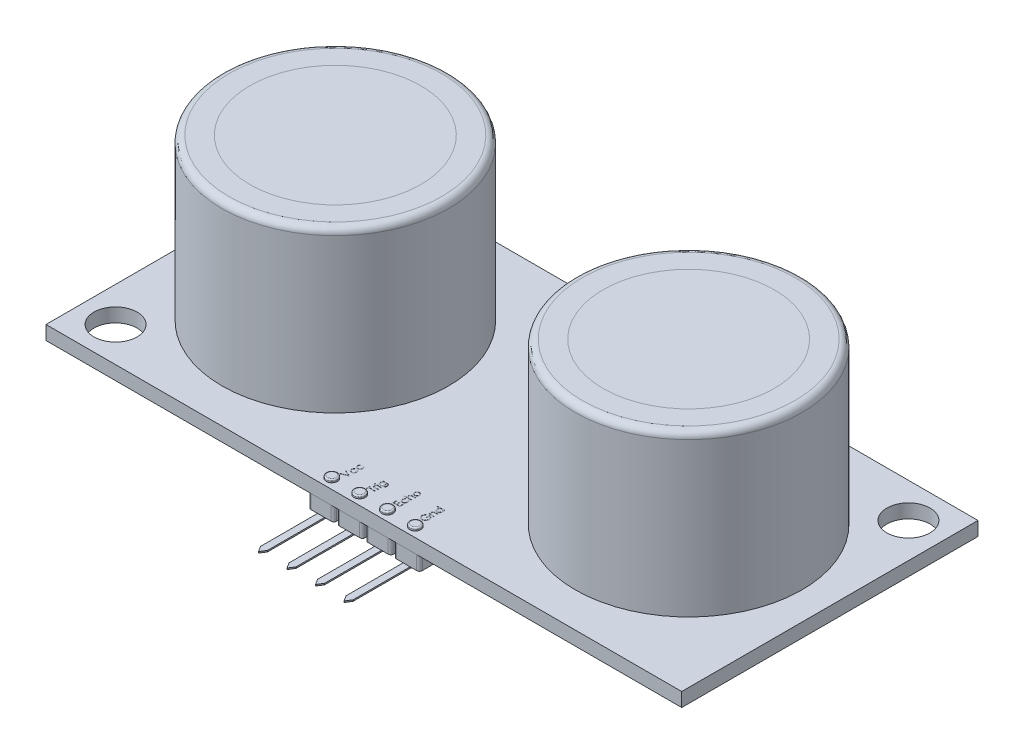
from build123d import *

# Parameters (mm, degrees)
SKETCH1_W              = 45.7
SKETCH1_H              = 21.3
SKETCH1_R              = 1.55
BOSS_EXTRUDE1_DEPTH    = 1
SKETCH2_R              = 8.15
SKETCH2_R_2            = 6.15
BOSS_EXTRUDE2_DEPTH    = 11.54
BOSS_EXTRUDE2_2_DEPTH  = 11.54
FILLET1_R              = 0.5
FILLET2_R              = 0.5
SKETCH3_R              = 6
BOSS_EXTRUDE3_DEPTH    = 7
BOSS_EXTRUDE3_2_DEPTH  = 7
LPATTERN2_COUNT        = 2
LPATTERN2_PITCH        = 25.4
SKETCH6_R              = 6.15
BOSS_EXTRUDE4_DEPTH    = 0.2
BOSS_EXTRUDE4_2_DEPTH  = 0.2
BOSS_EXTRUDE10_DEPTH   = 1
BOSS_EXTRUDE10_2_DEPTH = 1
BOSS_EXTRUDE10_3_DEPTH = 1
BOSS_EXTRUDE10_4_DEPTH = 1
SKETCH13_R             = 0.4
BOSS_EXTRUDE8_DEPTH    = 0.2
BOSS_EXTRUDE8_2_DEPTH  = 0.2
BOSS_EXTRUDE8_3_DEPTH  = 0.2
BOSS_EXTRUDE8_4_DEPTH  = 0.2
FILLET3_R              = 0.1
FILLET4_R              = 0.1
FILLET5_R              = 0.1
FILLET6_R              = 0.1
SKETCH15_W             = 0.365384615
SKETCH15_H             = 0.044871795
CUT_EXTRUDE5_DEPTH     = 0.01
BOSS_EXTRUDE11_DEPTH   = 0.1
BOSS_EXTRUDE11_2_DEPTH = 0.1
BOSS_EXTRUDE11_3_DEPTH = 0.1
BOSS_EXTRUDE11_4_DEPTH = 0.1
BOSS_EXTRUDE13_DEPTH   = 0.5
BOSS_EXTRUDE14_DEPTH   = 1.5
FILLET7_R              = 0.1


with BuildPart() as part:
    # Sketch1 → Boss-Extrude1 (new body)
    with BuildSketch(Plane(origin=(0, 0, 0), x_dir=(1, 0, 0), z_dir=(0, 1, 0))):
        Rectangle(SKETCH1_W, SKETCH1_H)
        with Locations(Location((20.35, 8.15, 0), (0, 0, 270))):
            Circle(SKETCH1_R, mode=Mode.SUBTRACT)
        with Locations(Location((-20.35, -8.15, 0), (0, 0, 270))):
            Circle(SKETCH1_R, mode=Mode.SUBTRACT)
    extrude(amount=BOSS_EXTRUDE1_DEPTH)

    # Sketch15 → Cut-Extrude5 (cut)
    # profile 1 of 15: a face of its own
    with BuildSketch(Plane(origin=(0, 1, 0), x_dir=(1, 0, 0), z_dir=(0, 1, 0))):
        with BuildLine():
            Line((-2.771008341, -8.073076923), (-2.747671001, -8.110637019))
            add(Edge.make_bspline(
                [(-2.747671001, -8.110637019), (-2.752789343, -8.114755571), (-2.76286393, -8.122862242), (-2.775865349, -8.136939276), (-2.787032069, -8.151940907), (-2.796132605, -8.168123485), (-2.803164241, -8.185464313), (-2.808139985, -8.203895006), (-2.811240591, -8.223412936), (-2.811592996, -8.236793678), (-2.811773565, -8.24364984)],
                knots=[0, 0, 0, 0, 1.026593902, 2.0206758, 2.988051866, 3.946915611, 4.916868779, 5.907761954, 6.927957743, 8, 8, 8, 8], degree=3))
            add(Edge.make_bspline(
                [(-2.811773565, -8.24364984), (-2.811622588, -8.249129691), (-2.811325242, -8.259922108), (-2.8094666, -8.275765844), (-2.80608917, -8.290857609), (-2.801639033, -8.305291996), (-2.795674706, -8.318966342), (-2.78841617, -8.331916473), (-2.779980449, -8.344257257), (-2.770207514, -8.355631077), (-2.759579133, -8.366035221), (-2.748185748, -8.375049352), (-2.736368621, -8.382897485), (-2.723832658, -8.389055479), (-2.71086465, -8.394094789), (-2.697219814, -8.397410035), (-2.683072955, -8.399619277), (-2.673427478, -8.399872038), (-2.668544398, -8.4)],
                knots=[0, 0, 0, 0, 1.112346261, 2.190735716, 3.231507886, 4.247384806, 5.251966152, 6.253067467, 7.256802811, 8.280671706, 9.291813951, 10.270744147, 11.225547591, 12.165006084, 13.100104208, 14.043489273, 15.009504848, 16, 16, 16, 16], degree=3))
            add(Edge.make_bspline(
                [(-2.668544398, -8.4), (-2.662149711, -8.399741969), (-2.649413775, -8.399228063), (-2.630645809, -8.395319409), (-2.612533755, -8.388779202), (-2.595175531, -8.379943686), (-2.579092049, -8.368728456), (-2.564665471, -8.355562063), (-2.552177566, -8.340430467), (-2.541824321, -8.323468787), (-2.533501276, -8.305074802), (-2.527571655, -8.28544765), (-2.523992745, -8.26474768), (-2.523541896, -8.250575287), (-2.523312027, -8.243349359)],
                knots=[0, 0, 0, 0, 0.96628757, 1.924499989, 2.884001032, 3.87047137, 4.860396324, 5.839257425, 6.814467993, 7.816059692, 8.834901047, 9.858382822, 10.908076205, 12, 12, 12, 12], degree=3))
            add(Edge.make_bspline(
                [(-2.523312027, -8.243349359), (-2.523497669, -8.23672719), (-2.523862506, -8.22371287), (-2.526938072, -8.204688972), (-2.531972877, -8.186577556), (-2.53899397, -8.169379266), (-2.548069329, -8.153125528), (-2.559263496, -8.13792136), (-2.572254439, -8.123464226), (-2.582299864, -8.114964658), (-2.587414591, -8.110637019)],
                knots=[0, 0, 0, 0, 1.039848629, 2.043578496, 3.018386758, 3.987534228, 4.954977003, 5.934852016, 6.948509513, 8, 8, 8, 8], degree=3))
            Line((-2.587414591, -8.110637019), (-2.562775168, -8.073076923))
            add(Edge.make_bspline(
                [(-2.562775168, -8.073076923), (-2.559505064, -8.075303738), (-2.55297571, -8.079749976), (-2.543769408, -8.087182494), (-2.535152024, -8.095199613), (-2.527135111, -8.103770055), (-2.519526823, -8.112781914), (-2.512690884, -8.122543043), (-2.506243052, -8.132738702), (-2.500441213, -8.143488582), (-2.495226024, -8.154681539), (-2.490741571, -8.166301823), (-2.486888699, -8.178298939), (-2.483826221, -8.190686993), (-2.481381815, -8.203490407), (-2.479759858, -8.216676069), (-2.478549104, -8.230239438), (-2.478476837, -8.239406888), (-2.478440232, -8.244050481)],
                knots=[0, 0, 0, 0, 0.954134338, 1.905101784, 2.851144739, 3.791306361, 4.734911809, 5.6936923, 6.663572882, 7.643865596, 8.638447847, 9.640600242, 10.646758161, 11.676244097, 12.717260333, 13.78922464, 14.880174919, 16, 16, 16, 16], degree=3))
            add(Edge.make_bspline(
                [(-2.478440232, -8.244050481), (-2.478567769, -8.251137657), (-2.478817743, -8.265028574), (-2.481558826, -8.285361669), (-2.485706466, -8.304787443), (-2.491608966, -8.323340034), (-2.499403895, -8.340906018), (-2.508707421, -8.357631633), (-2.519826998, -8.373344282), (-2.532498463, -8.387940957), (-2.546251285, -8.401289611), (-2.561005999, -8.41290504), (-2.576436566, -8.422748753), (-2.592640251, -8.430857682), (-2.60955061, -8.437198108), (-2.627270949, -8.441563266), (-2.645650922, -8.444379814), (-2.658184043, -8.444706284), (-2.664537988, -8.444871795)],
                knots=[0, 0, 0, 0, 1.113096611, 2.181677437, 3.217994567, 4.231807234, 5.234933164, 6.233258928, 7.234764453, 8.254006763, 9.267004511, 10.242118657, 11.199842941, 12.138404996, 13.084707599, 14.031460992, 15.002005182, 16, 16, 16, 16], degree=3))
            add(Edge.make_bspline(
                [(-2.664537988, -8.444871795), (-2.668849193, -8.444808793), (-2.677424891, -8.444683471), (-2.690152758, -8.443246052), (-2.702711122, -8.441389128), (-2.714940796, -8.438242594), (-2.727027266, -8.434608218), (-2.738824852, -8.429968856), (-2.750388376, -8.424526657), (-2.761688052, -8.418347807), (-2.772537986, -8.411392272), (-2.78278851, -8.403694953), (-2.792562762, -8.395545762), (-2.801523299, -8.386563461), (-2.810028469, -8.377129224), (-2.817851059, -8.366976142), (-2.825014057, -8.356162449), (-2.831649917, -8.344850546), (-2.837558407, -8.333047016), (-2.84264887, -8.320823206), (-2.846999238, -8.308252773), (-2.850443369, -8.295315609), (-2.853331572, -8.282097585), (-2.855148408, -8.268494536), (-2.856432161, -8.254558505), (-2.856573703, -8.24512193), (-2.85664536, -8.240344551)],
                knots=[0, 0, 0, 0, 0.990994727, 1.971252077, 2.943264845, 3.907940874, 4.872158414, 5.844625996, 6.82015047, 7.809835459, 8.804511986, 9.781214284, 10.756496977, 11.728388426, 12.696359165, 13.676225489, 14.672885716, 15.677705647, 16.690706858, 17.706033469, 18.721040654, 19.747369689, 20.783475414, 21.830280724, 22.901553713, 24, 24, 24, 24], degree=3))
            add(Edge.make_bspline(
                [(-2.85664536, -8.240344551), (-2.856513675, -8.234361671), (-2.856250963, -8.222425816), (-2.854039524, -8.204720112), (-2.850706512, -8.187274669), (-2.84576471, -8.170398053), (-2.839794347, -8.154285867), (-2.833049525, -8.139243645), (-2.825383038, -8.125498557), (-2.816841822, -8.112929361), (-2.807112014, -8.101539541), (-2.796292651, -8.091037172), (-2.784305854, -8.081353058), (-2.775477426, -8.075858402), (-2.771008341, -8.073076923)],
                knots=[0, 0, 0, 0, 1.095139042, 2.184804066, 3.262657822, 4.34424993, 5.400369085, 6.407210964, 7.359649996, 8.278719237, 9.185177137, 10.097389079, 11.036869154, 12, 12, 12, 12], degree=3))
        make_face()
    # profile 2 of 15: a face of its own
    with BuildSketch(Plane(origin=(0, 1, 0), x_dir=(1, 0, 0), z_dir=(0, 1, 0))):
        with BuildLine():
            Line((-2.771008341, -8.521794872), (-2.747671001, -8.559354968))
            add(Edge.make_bspline(
                [(-2.747671001, -8.559354968), (-2.752789343, -8.56347352), (-2.76286393, -8.571580191), (-2.775865349, -8.585657225), (-2.787032069, -8.600658855), (-2.796132605, -8.616841434), (-2.803164241, -8.634182262), (-2.808139985, -8.652612955), (-2.811240591, -8.672130884), (-2.811592996, -8.685511627), (-2.811773565, -8.692367788)],
                knots=[0, 0, 0, 0, 1.026593902, 2.0206758, 2.988051866, 3.946915611, 4.916868779, 5.907761954, 6.927957743, 8, 8, 8, 8], degree=3))
            add(Edge.make_bspline(
                [(-2.811773565, -8.692367788), (-2.811622588, -8.697847639), (-2.811325242, -8.708640057), (-2.8094666, -8.724483793), (-2.80608917, -8.739575558), (-2.801639033, -8.754009945), (-2.795674706, -8.76768429), (-2.78841617, -8.780634422), (-2.779980449, -8.792975206), (-2.770207514, -8.804349026), (-2.759579133, -8.81475317), (-2.748185748, -8.823767301), (-2.736368621, -8.831615434), (-2.723832658, -8.837773428), (-2.71086465, -8.842812738), (-2.697219814, -8.846127983), (-2.683072955, -8.848337226), (-2.673427478, -8.848589987), (-2.668544398, -8.848717949)],
                knots=[0, 0, 0, 0, 1.112346261, 2.190735716, 3.231507886, 4.247384806, 5.251966152, 6.253067467, 7.256802811, 8.280671706, 9.291813951, 10.270744147, 11.225547591, 12.165006084, 13.100104208, 14.043489273, 15.009504848, 16, 16, 16, 16], degree=3))
            add(Edge.make_bspline(
                [(-2.668544398, -8.848717949), (-2.662149711, -8.848459918), (-2.649413775, -8.847946012), (-2.630645809, -8.844037358), (-2.612533755, -8.837497151), (-2.595175531, -8.828661635), (-2.579092049, -8.817446404), (-2.564665471, -8.804280012), (-2.552177566, -8.789148415), (-2.541824321, -8.772186736), (-2.533501276, -8.75379275), (-2.527571655, -8.734165599), (-2.523992745, -8.713465628), (-2.523541896, -8.699293236), (-2.523312027, -8.692067308)],
                knots=[0, 0, 0, 0, 0.96628757, 1.924499989, 2.884001032, 3.87047137, 4.860396324, 5.839257425, 6.814467993, 7.816059692, 8.834901047, 9.858382822, 10.908076205, 12, 12, 12, 12], degree=3))
            add(Edge.make_bspline(
                [(-2.523312027, -8.692067308), (-2.523497669, -8.685445138), (-2.523862506, -8.672430819), (-2.526938072, -8.653406921), (-2.531972877, -8.635295505), (-2.53899397, -8.618097215), (-2.548069329, -8.601843477), (-2.559263496, -8.586639309), (-2.572254439, -8.572182175), (-2.582299864, -8.563682607), (-2.587414591, -8.559354968)],
                knots=[0, 0, 0, 0, 1.039848629, 2.043578496, 3.018386758, 3.987534228, 4.954977003, 5.934852016, 6.948509513, 8, 8, 8, 8], degree=3))
            Line((-2.587414591, -8.559354968), (-2.562775168, -8.521794872))
            add(Edge.make_bspline(
                [(-2.562775168, -8.521794872), (-2.559505064, -8.524021686), (-2.55297571, -8.528467925), (-2.543769408, -8.535900442), (-2.535152024, -8.543917561), (-2.527135111, -8.552488004), (-2.519526823, -8.561499862), (-2.512690884, -8.571260992), (-2.506243052, -8.581456651), (-2.500441213, -8.592206531), (-2.495226024, -8.603399487), (-2.490741571, -8.615019772), (-2.486888699, -8.627016888), (-2.483826221, -8.639404942), (-2.481381815, -8.652208356), (-2.479759858, -8.665394018), (-2.478549104, -8.678957386), (-2.478476837, -8.688124837), (-2.478440232, -8.692768429)],
                knots=[0, 0, 0, 0, 0.954134338, 1.905101784, 2.851144739, 3.791306361, 4.734911809, 5.6936923, 6.663572882, 7.643865596, 8.638447847, 9.640600242, 10.646758161, 11.676244097, 12.717260333, 13.78922464, 14.880174919, 16, 16, 16, 16], degree=3))
            add(Edge.make_bspline(
                [(-2.478440232, -8.692768429), (-2.478567769, -8.699855606), (-2.478817743, -8.713746523), (-2.481558826, -8.734079618), (-2.485706466, -8.753505392), (-2.491608966, -8.772057982), (-2.499403895, -8.789623967), (-2.508707421, -8.806349582), (-2.519826998, -8.82206223), (-2.532498463, -8.836658905), (-2.546251285, -8.85000756), (-2.561005999, -8.861622989), (-2.576436566, -8.871466702), (-2.592640251, -8.879575631), (-2.60955061, -8.885916057), (-2.627270949, -8.890281215), (-2.645650922, -8.893097763), (-2.658184043, -8.893424232), (-2.664537988, -8.893589744)],
                knots=[0, 0, 0, 0, 1.113096611, 2.181677437, 3.217994567, 4.231807234, 5.234933164, 6.233258928, 7.234764453, 8.254006763, 9.267004511, 10.242118657, 11.199842941, 12.138404996, 13.084707599, 14.031460992, 15.002005182, 16, 16, 16, 16], degree=3))
            add(Edge.make_bspline(
                [(-2.664537988, -8.893589744), (-2.668849193, -8.893526741), (-2.677424891, -8.893401419), (-2.690152758, -8.891964001), (-2.702711122, -8.890107076), (-2.714940796, -8.886960542), (-2.727027266, -8.883326167), (-2.738824852, -8.878686805), (-2.750388376, -8.873244606), (-2.761688052, -8.867065756), (-2.772537986, -8.860110221), (-2.78278851, -8.852412902), (-2.792562762, -8.844263711), (-2.801523299, -8.835281409), (-2.810028469, -8.825847173), (-2.817851059, -8.815694091), (-2.825014057, -8.804880398), (-2.831649917, -8.793568494), (-2.837558407, -8.781764964), (-2.84264887, -8.769541154), (-2.846999238, -8.756970721), (-2.850443369, -8.744033558), (-2.853331572, -8.730815533), (-2.855148408, -8.717212485), (-2.856432161, -8.703276453), (-2.856573703, -8.693839879), (-2.85664536, -8.6890625)],
                knots=[0, 0, 0, 0, 0.990994727, 1.971252077, 2.943264845, 3.907940874, 4.872158414, 5.844625996, 6.82015047, 7.809835459, 8.804511986, 9.781214284, 10.756496977, 11.728388426, 12.696359165, 13.676225489, 14.672885716, 15.677705647, 16.690706858, 17.706033469, 18.721040654, 19.747369689, 20.783475414, 21.830280724, 22.901553713, 24, 24, 24, 24], degree=3))
            add(Edge.make_bspline(
                [(-2.85664536, -8.6890625), (-2.856513675, -8.68307962), (-2.856250963, -8.671143765), (-2.854039524, -8.65343806), (-2.850706512, -8.635992617), (-2.84576471, -8.619116001), (-2.839794347, -8.603003815), (-2.833049525, -8.587961594), (-2.825383038, -8.574216505), (-2.816841822, -8.561647309), (-2.807112014, -8.550257489), (-2.796292651, -8.539755121), (-2.784305854, -8.530071007), (-2.775477426, -8.524576351), (-2.771008341, -8.521794872)],
                knots=[0, 0, 0, 0, 1.095139042, 2.184804066, 3.262657822, 4.34424993, 5.400369085, 6.407210964, 7.359649996, 8.278719237, 9.185177137, 10.097389079, 11.036869154, 12, 12, 12, 12], degree=3))
        make_face()
    # profile 3 of 15: a face of its own
    with BuildSketch(Plane(origin=(0, 1, 0), x_dir=(1, 0, 0), z_dir=(0, 1, 0))):
        Polygon((-2.984850488, -9.393589744), (-2.984850488, -9.345512821), (-2.590820039, -9.178846154), (-2.984850488, -9.012179487), (-2.984850488, -8.964102564), (-2.484850488, -9.175641026), (-2.484850488, -9.182051282), align=None)
    # profile 4 of 15: a face of its own
    with BuildSketch(Plane(origin=(0, 1, 0), x_dir=(1, 0, 0), z_dir=(0, 1, 0))):
        with BuildLine():
            Line((-0.997671001, -8.323076923), (-0.997671001, -8.278205128))
            Line((-0.997671001, -8.278205128), (-0.707707059, -8.278205128))
            add(Edge.make_bspline(
                [(-0.707707059, -8.278205128), (-0.701530259, -8.278244706), (-0.689607549, -8.2783211), (-0.672367795, -8.278871239), (-0.656444068, -8.280031335), (-0.641763746, -8.281346861), (-0.628394873, -8.283239249), (-0.616297558, -8.285550159), (-0.605460192, -8.288155256), (-0.598785214, -8.290443858), (-0.595627732, -8.291526442)],
                knots=[0, 0, 0, 0, 1.307562039, 2.523909702, 3.650326591, 4.686913197, 5.643429486, 6.506965704, 7.293745905, 8, 8, 8, 8], degree=3))
            add(Edge.make_bspline(
                [(-0.595627732, -8.291526442), (-0.591523467, -8.293124913), (-0.583437652, -8.29627406), (-0.571975468, -8.302171897), (-0.561183639, -8.308777152), (-0.551119247, -8.316319448), (-0.54184421, -8.324773833), (-0.533128421, -8.333892025), (-0.525299785, -8.343993911), (-0.518264274, -8.354902601), (-0.511803718, -8.366397845), (-0.50629187, -8.378566079), (-0.501694755, -8.391341933), (-0.497912126, -8.404666455), (-0.494860467, -8.418538869), (-0.492824357, -8.433005352), (-0.49145333, -8.448017017), (-0.491325565, -8.458223325), (-0.491260745, -8.463401442)],
                knots=[0, 0, 0, 0, 0.98202571, 1.934689484, 2.871054655, 3.802072519, 4.735470746, 5.668036537, 6.612630213, 7.581518814, 8.561763468, 9.551722253, 10.55777311, 11.588015789, 12.63986657, 13.723744117, 14.845153492, 16, 16, 16, 16], degree=3))
            add(Edge.make_bspline(
                [(-0.491260745, -8.463401442), (-0.491398444, -8.470954291), (-0.491667335, -8.485703082), (-0.494237549, -8.507250304), (-0.498383337, -8.527647451), (-0.504290118, -8.546745865), (-0.51159439, -8.564353393), (-0.519961827, -8.580371702), (-0.529561107, -8.594653137), (-0.540489557, -8.607527987), (-0.553484427, -8.619148203), (-0.56879853, -8.630080676), (-0.586665234, -8.640603667), (-0.599778478, -8.646770615), (-0.60664536, -8.65)],
                knots=[0, 0, 0, 0, 1.157856589, 2.260999188, 3.322382479, 4.345906448, 5.321474636, 6.242187631, 7.112686896, 7.955149481, 8.825136643, 9.778649332, 10.836767353, 12, 12, 12, 12], degree=3))
            Line((-0.60664536, -8.65), (-0.60664536, -8.605128205))
            add(Edge.make_bspline(
                [(-0.60664536, -8.605128205), (-0.600917786, -8.601517682), (-0.589721084, -8.594459554), (-0.575209435, -8.581304421), (-0.562921457, -8.566781581), (-0.552951172, -8.55058289), (-0.545275698, -8.53259537), (-0.539944399, -8.512702648), (-0.536718994, -8.490850286), (-0.536333356, -8.475632713), (-0.536132539, -8.467708333)],
                knots=[0, 0, 0, 0, 0.997887113, 1.950746426, 2.877762071, 3.798308985, 4.747694893, 5.754452072, 6.830656281, 8, 8, 8, 8], degree=3))
            add(Edge.make_bspline(
                [(-0.536132539, -8.467708333), (-0.536335992, -8.459884147), (-0.536728227, -8.4447999), (-0.53994568, -8.423114342), (-0.545277357, -8.403286508), (-0.552935516, -8.38553539), (-0.562134175, -8.369971421), (-0.57230764, -8.356477096), (-0.583915231, -8.345633881), (-0.594592505, -8.338312809), (-0.604111131, -8.333766176), (-0.61230383, -8.330868136), (-0.621538296, -8.328530902), (-0.631836565, -8.326524556), (-0.643202589, -8.324934754), (-0.65567513, -8.323891683), (-0.669169826, -8.323151364), (-0.678525914, -8.32310231), (-0.683368116, -8.323076923)],
                knots=[0, 0, 0, 0, 1.570880491, 3.028500349, 4.391799536, 5.683507043, 6.897971719, 8.016608159, 9.065046722, 10.074948333, 10.602832593, 11.179761774, 11.817338097, 12.514350094, 13.286299219, 14.121078732, 15.027572402, 16, 16, 16, 16], degree=3))
            Line((-0.683368116, -8.323076923), (-0.702298405, -8.323076923))
            add(Edge.make_bspline(
                [(-0.702298405, -8.323076923), (-0.696880347, -8.327632902), (-0.686139534, -8.336664722), (-0.672040067, -8.3522204), (-0.660043648, -8.369318353), (-0.650065029, -8.387716899), (-0.642159081, -8.407141835), (-0.636430531, -8.427249727), (-0.632877272, -8.447984125), (-0.632484744, -8.462018483), (-0.632286386, -8.469110577)],
                knots=[0, 0, 0, 0, 1.012670515, 2.007528466, 2.995541538, 3.996581493, 4.997861088, 5.991949332, 6.98525577, 8, 8, 8, 8], degree=3))
            add(Edge.make_bspline(
                [(-0.632286386, -8.469110577), (-0.632374509, -8.473285601), (-0.632549648, -8.481583134), (-0.63361503, -8.493945102), (-0.635689687, -8.506068824), (-0.638346295, -8.51803153), (-0.641907404, -8.529749643), (-0.646087008, -8.54136357), (-0.651220666, -8.552704648), (-0.657000461, -8.563830743), (-0.663494463, -8.574480094), (-0.670510718, -8.584619216), (-0.67803427, -8.594185751), (-0.686133585, -8.603091069), (-0.694798441, -8.611322851), (-0.703936073, -8.618991983), (-0.713674184, -8.625971602), (-0.723835177, -8.632404944), (-0.734486738, -8.637984594), (-0.745397894, -8.642882361), (-0.756545316, -8.647140847), (-0.767966325, -8.650535905), (-0.779653721, -8.653128921), (-0.791588356, -8.655058953), (-0.803806983, -8.656153658), (-0.812038604, -8.656324361), (-0.816180616, -8.656410256)],
                knots=[0, 0, 0, 0, 1.028710361, 2.044481286, 3.053267669, 4.056977562, 5.061496029, 6.068537106, 7.095799505, 8.125955792, 9.155750787, 10.166547241, 11.162135275, 12.151998358, 13.129411568, 14.10464185, 15.088574784, 16.079052837, 17.065149435, 18.048153627, 19.024354702, 20.002874835, 20.980703288, 21.971932454, 22.97951087, 24, 24, 24, 24], degree=3))
            add(Edge.make_bspline(
                [(-0.816180616, -8.656410256), (-0.820323916, -8.65633609), (-0.828594467, -8.656188044), (-0.840862951, -8.654909333), (-0.852967156, -8.653085305), (-0.864782319, -8.650198481), (-0.876442998, -8.646723835), (-0.887863063, -8.642420468), (-0.899045993, -8.637246359), (-0.910000069, -8.631387824), (-0.920578299, -8.624804382), (-0.930624963, -8.617585456), (-0.94006613, -8.609722331), (-0.948997048, -8.601323486), (-0.957331547, -8.592286369), (-0.965049399, -8.582615656), (-0.972279974, -8.572406673), (-0.978867308, -8.56162778), (-0.984693343, -8.550445296), (-0.990009429, -8.539143322), (-0.994228588, -8.527572146), (-0.997946174, -8.515947497), (-1.000579773, -8.504064652), (-1.002611522, -8.49206931), (-1.003849339, -8.479920405), (-1.004003852, -8.471784277), (-1.004081257, -8.467708333)],
                knots=[0, 0, 0, 0, 1.008818848, 2.013730394, 3.001654427, 3.987803273, 4.973046549, 5.963777569, 6.957074694, 7.972068341, 8.987420212, 9.989399531, 10.982630087, 11.977756091, 12.973280677, 13.973972381, 14.989194003, 16.018387222, 17.047741039, 18.059210846, 19.057554164, 20.045176975, 21.029480261, 22.018708529, 23.007435371, 24, 24, 24, 24], degree=3))
            add(Edge.make_bspline(
                [(-1.004081257, -8.467708333), (-1.003887447, -8.460986771), (-1.003504731, -8.44771375), (-1.00050171, -8.428180749), (-0.995713994, -8.409331858), (-0.988854618, -8.391060713), (-0.979490327, -8.373218477), (-0.96715562, -8.355863955), (-0.951739857, -8.338946935), (-0.939918019, -8.328507245), (-0.933768757, -8.323076923)],
                knots=[0, 0, 0, 0, 0.96728863, 1.910097829, 2.838038873, 3.762875196, 4.71315279, 5.730631239, 6.819562287, 8, 8, 8, 8], degree=3))
            Line((-0.933768757, -8.323076923), (-0.997671001, -8.323076923))
        make_face()
        with BuildLine():
            add(Edge.make_bspline(
                [(-0.959209462, -8.464102564), (-0.958985635, -8.470663676), (-0.958542503, -8.483653286), (-0.954785181, -8.502700557), (-0.948838122, -8.521046355), (-0.940560513, -8.538509789), (-0.930099085, -8.55468857), (-0.917652726, -8.569167271), (-0.903392187, -8.581790654), (-0.887501177, -8.592471897), (-0.87033042, -8.601004597), (-0.852239491, -8.606965045), (-0.83354441, -8.610904833), (-0.820807971, -8.611325885), (-0.814377732, -8.611538462)],
                knots=[0, 0, 0, 0, 1.026191648, 2.031641866, 3.026511193, 4.038688626, 5.047555432, 6.033268986, 7.01798463, 8.019529538, 9.022150945, 10.008736843, 10.994672018, 12, 12, 12, 12], degree=3))
            add(Edge.make_bspline(
                [(-0.814377732, -8.611538462), (-0.809530278, -8.611434365), (-0.799996755, -8.611229639), (-0.786003388, -8.609275066), (-0.772655107, -8.606077365), (-0.759964589, -8.601659433), (-0.747930218, -8.59601418), (-0.736552832, -8.589051405), (-0.725826064, -8.58080999), (-0.71584043, -8.571403184), (-0.70674619, -8.561034715), (-0.698754992, -8.549789226), (-0.692219188, -8.537681303), (-0.686570493, -8.52500891), (-0.682444913, -8.511464514), (-0.679296516, -8.497243217), (-0.677495265, -8.482244403), (-0.677272008, -8.472019868), (-0.67715818, -8.466806891)],
                knots=[0, 0, 0, 0, 1.039710933, 2.044807362, 3.024849673, 3.981007225, 4.923240656, 5.871799057, 6.837597342, 7.820855272, 8.810901995, 9.792827897, 10.773995565, 11.758948565, 12.765014796, 13.806304263, 14.881544521, 16, 16, 16, 16], degree=3))
            add(Edge.make_bspline(
                [(-0.67715818, -8.466806891), (-0.677267839, -8.461526354), (-0.677482275, -8.45120032), (-0.679325632, -8.436118758), (-0.6823002, -8.421828366), (-0.686523489, -8.408342249), (-0.691912311, -8.395609486), (-0.698731827, -8.383773112), (-0.706498175, -8.372579334), (-0.715557034, -8.362385561), (-0.725540605, -8.353167823), (-0.736404161, -8.345134857), (-0.747984235, -8.338289935), (-0.760279522, -8.332621697), (-0.773385572, -8.328294382), (-0.787269623, -8.325391681), (-0.801865157, -8.323362146), (-0.811866388, -8.323173443), (-0.816981898, -8.323076923)],
                knots=[0, 0, 0, 0, 1.121943988, 2.193949579, 3.223793937, 4.220241907, 5.192961521, 6.155822191, 7.11847367, 8.083710714, 9.04790392, 10.001595906, 10.949595423, 11.902125208, 12.873731292, 13.87582262, 14.913508608, 16, 16, 16, 16], degree=3))
            add(Edge.make_bspline(
                [(-0.816981898, -8.323076923), (-0.82364145, -8.323268633), (-0.836651874, -8.323643168), (-0.85561197, -8.327166515), (-0.873457556, -8.33288198), (-0.890142968, -8.34081413), (-0.905435801, -8.350799757), (-0.918948802, -8.362944844), (-0.931054645, -8.376711981), (-0.941008495, -8.392437847), (-0.949122007, -8.409269981), (-0.955011523, -8.426960133), (-0.958478604, -8.445337173), (-0.958964441, -8.457811434), (-0.959209462, -8.464102564)],
                knots=[0, 0, 0, 0, 1.070678282, 2.091729125, 3.090678259, 4.078281522, 5.055707048, 6.018451281, 6.993304669, 7.996175111, 9.002951586, 9.993356152, 10.987991402, 12, 12, 12, 12], degree=3))
        make_face(mode=Mode.SUBTRACT)
    # profile 5 of 15: a face of its own
    with BuildSketch(Plane(origin=(0, 1, 0), x_dir=(1, 0, 0), z_dir=(0, 1, 0))):
        with BuildLine():
            add(Edge.make_bspline(
                [(-1.151517155, -8.768790064), (-1.15138799, -8.76600559), (-1.151135061, -8.760553056), (-1.148969136, -8.752668304), (-1.145297752, -8.74548873), (-1.140372083, -8.739120483), (-1.134579306, -8.733655928), (-1.127827739, -8.729830112), (-1.120533648, -8.727371198), (-1.115445778, -8.727074262), (-1.112855296, -8.726923077)],
                knots=[0, 0, 0, 0, 1.055194115, 2.066272739, 3.074728998, 4.095836921, 5.109056067, 6.073838105, 7.019297344, 8, 8, 8, 8], degree=3))
            add(Edge.make_bspline(
                [(-1.112855296, -8.726923077), (-1.11033206, -8.727077671), (-1.10534392, -8.727383286), (-1.098176281, -8.729828213), (-1.091518527, -8.733688532), (-1.085736997, -8.739116979), (-1.080814051, -8.745489659), (-1.077141945, -8.752668057), (-1.074976211, -8.760553121), (-1.074723256, -8.766005612), (-1.074594078, -8.768790064)],
                knots=[0, 0, 0, 0, 0.96129708, 1.900370562, 2.859976407, 3.87933698, 4.906634145, 5.921202961, 6.938410037, 8, 8, 8, 8], degree=3))
            add(Edge.make_bspline(
                [(-1.074594078, -8.768790064), (-1.074718324, -8.771542675), (-1.074960152, -8.776900272), (-1.07718444, -8.784666964), (-1.080815308, -8.791785319), (-1.085704763, -8.798165987), (-1.091554034, -8.803484586), (-1.098172218, -8.807355775), (-1.105344955, -8.809795056), (-1.110332407, -8.810101431), (-1.112855296, -8.81025641)],
                knots=[0, 0, 0, 0, 1.054934014, 2.053291228, 3.073705704, 4.106921865, 5.123545215, 6.088680038, 7.033164197, 8, 8, 8, 8], degree=3))
            add(Edge.make_bspline(
                [(-1.112855296, -8.81025641), (-1.115445417, -8.810104826), (-1.120532579, -8.809807106), (-1.127831869, -8.807353947), (-1.134543512, -8.803516831), (-1.140404298, -8.798162465), (-1.145296503, -8.791786257), (-1.148926643, -8.784666722), (-1.15115112, -8.776900336), (-1.151392922, -8.771542697), (-1.151517155, -8.768790064)],
                knots=[0, 0, 0, 0, 0.98631895, 1.937192651, 2.907499808, 3.917963147, 4.944918757, 5.95915025, 6.951458133, 8, 8, 8, 8], degree=3))
        make_face()
    # profile 6 of 15: a face of its own
    with BuildSketch(Plane(origin=(0, 1, 0), x_dir=(1, 0, 0), z_dir=(0, 1, 0))):
        with Locations((-0.814978694, -8.768589744)):
            Rectangle(SKETCH15_W, SKETCH15_H)
    # profile 7 of 15: a face of its own
    with BuildSketch(Plane(origin=(0, 1, 0), x_dir=(1, 0, 0), z_dir=(0, 1, 0))):
        with BuildLine():
            Line((-0.997671001, -9.008974359), (-0.997671001, -8.964102564))
            Line((-0.997671001, -8.964102564), (-0.943884943, -8.964102564))
            add(Edge.make_bspline(
                [(-0.943884943, -8.964102564), (-0.948895161, -8.960792004), (-0.958477163, -8.954460583), (-0.971132965, -8.943887752), (-0.98173113, -8.933173527), (-0.990069549, -8.922036573), (-0.996371357, -8.910586078), (-1.00079944, -8.898918598), (-1.003545429, -8.887005603), (-1.003902409, -8.878980537), (-1.004081257, -8.874959936)],
                knots=[0, 0, 0, 0, 1.280091057, 2.448164201, 3.510831157, 4.48793739, 5.405868014, 6.289422536, 7.142991551, 8, 8, 8, 8], degree=3))
            add(Edge.make_bspline(
                [(-1.004081257, -8.874959936), (-1.003911182, -8.871841889), (-1.003561241, -8.865426306), (-1.001102552, -8.855714507), (-0.99717712, -8.8457083), (-0.99348566, -8.839259387), (-0.991561225, -8.835897436)],
                knots=[0, 0, 0, 0, 0.901110191, 1.854092781, 2.881294221, 4, 4, 4, 4], degree=3))
            Line((-0.991561225, -8.835897436), (-0.952699046, -8.860536859))
            add(Edge.make_bspline(
                [(-0.952699046, -8.860536859), (-0.953661941, -8.862695291), (-0.9554897, -8.866792407), (-0.957652845, -8.872785916), (-0.958926547, -8.878311822), (-0.959119506, -8.88183233), (-0.959209462, -8.883473558)],
                knots=[0, 0, 0, 0, 1.180555205, 2.24091978, 3.179933427, 4, 4, 4, 4], degree=3))
            add(Edge.make_bspline(
                [(-0.959209462, -8.883473558), (-0.958971337, -8.887075458), (-0.958485629, -8.89442229), (-0.954612677, -8.905172481), (-0.948535131, -8.915697534), (-0.941614604, -8.923975853), (-0.934966832, -8.930408263), (-0.929148566, -8.935034288), (-0.922564165, -8.939186215), (-0.915468132, -8.943213694), (-0.907682376, -8.946955526), (-0.899194196, -8.950299403), (-0.890073683, -8.953426571), (-0.883731978, -8.955187649), (-0.880483501, -8.956089744)],
                knots=[0, 0, 0, 0, 1.125322384, 2.295331465, 3.535939348, 4.916963136, 5.656144286, 6.429838446, 7.238666481, 8.090384391, 8.983239461, 9.940052224, 10.944811494, 12, 12, 12, 12], degree=3))
            add(Edge.make_bspline(
                [(-0.880483501, -8.956089744), (-0.877586922, -8.956766968), (-0.871139047, -8.958274491), (-0.860370848, -8.959701119), (-0.847656758, -8.961167459), (-0.832982009, -8.962168822), (-0.81629019, -8.963114743), (-0.79765331, -8.963637309), (-0.777020145, -8.964085938), (-0.762628594, -8.964096845), (-0.75508286, -8.964102564)],
                knots=[0, 0, 0, 0, 0.566841273, 1.261806378, 2.068780918, 3.007109044, 4.065315289, 5.256255371, 6.561408263, 8, 8, 8, 8], degree=3))
            Line((-0.75508286, -8.964102564), (-0.632286386, -8.964102564))
            Line((-0.632286386, -8.964102564), (-0.632286386, -9.008974359))
            Line((-0.632286386, -9.008974359), (-0.997671001, -9.008974359))
        make_face()
    # profile 8 of 15: a face of its own
    with BuildSketch(Plane(origin=(0, 1, 0), x_dir=(1, 0, 0), z_dir=(0, 1, 0))):
        Polygon((-1.081004334, -9.335897436), (-1.132286386, -9.335897436), (-1.132286386, -9.073076923), (-1.081004334, -9.073076923), (-1.081004334, -9.182051282), (-0.632286386, -9.182051282), (-0.632286386, -9.226923077), (-1.081004334, -9.226923077), align=None)
    # profile 9 of 15: a face of its own
    with BuildSketch(Plane(origin=(0, 1, 0), x_dir=(1, 0, 0), z_dir=(0, 1, 0))):
        with BuildLine():
            add(Edge.make_bspline(
                [(0.848482845, -7.877363782), (0.84862883, -7.870507886), (0.84891507, -7.857065149), (0.85197435, -7.837378308), (0.856652545, -7.818586146), (0.863119911, -7.80061669), (0.871788761, -7.783700076), (0.882132946, -7.767589899), (0.894387602, -7.752330326), (0.903867326, -7.743184179), (0.908679159, -7.738541667)],
                knots=[0, 0, 0, 0, 1.054011418, 2.066658804, 3.057071809, 4.030435133, 4.997543892, 5.974964718, 6.972108034, 8, 8, 8, 8], degree=3))
            add(Edge.make_bspline(
                [(0.908679159, -7.738541667), (0.913281157, -7.734544245), (0.922396092, -7.726626762), (0.937175465, -7.716474516), (0.952481194, -7.707728579), (0.968516526, -7.700719585), (0.985141479, -7.695193153), (1.002413195, -7.691269482), (1.02029353, -7.688935634), (1.032436936, -7.688620924), (1.038587012, -7.688461538)],
                knots=[0, 0, 0, 0, 1.025258237, 2.030674902, 3.01204498, 3.988269485, 4.97094183, 5.956517959, 6.965070386, 8, 8, 8, 8], degree=3))
            add(Edge.make_bspline(
                [(1.038587012, -7.688461538), (1.044772734, -7.68860173), (1.056996011, -7.688878754), (1.074998777, -7.69149927), (1.09245518, -7.69557514), (1.109292137, -7.701408259), (1.125561112, -7.708887989), (1.141191048, -7.71801523), (1.156212781, -7.728854033), (1.170498758, -7.741140318), (1.18366536, -7.754719157), (1.195140827, -7.769450036), (1.204972473, -7.785043469), (1.212891961, -7.801706805), (1.219136204, -7.819287875), (1.223521921, -7.837824599), (1.22617359, -7.85728818), (1.2265141, -7.870577783), (1.226687973, -7.877363782)],
                knots=[0, 0, 0, 0, 0.998656419, 1.973391657, 2.932242238, 3.890759089, 4.846373663, 5.82037756, 6.809684879, 7.83454468, 8.860553229, 9.859544525, 10.845671541, 11.83227036, 12.833544569, 13.85385346, 14.904124723, 16, 16, 16, 16], degree=3))
            add(Edge.make_bspline(
                [(1.226687973, -7.877363782), (1.226513517, -7.884183028), (1.226171835, -7.897538865), (1.223532223, -7.917071148), (1.219138225, -7.935641093), (1.212871441, -7.953245179), (1.20497222, -7.969980157), (1.19517055, -7.985663942), (1.183661957, -8.000406787), (1.17049968, -8.0139885), (1.156212543, -8.026274015), (1.141191109, -8.037113016), (1.125561096, -8.046240205), (1.109292141, -8.053719949), (1.092455179, -8.059553065), (1.074998777, -8.063628935), (1.056996011, -8.066249452), (1.044772734, -8.066526476), (1.038587012, -8.066666667)],
                knots=[0, 0, 0, 0, 1.099876186, 2.154163076, 3.173186993, 4.173200201, 5.163417411, 6.152872554, 7.150605724, 8.17532212, 9.198891216, 10.186952605, 11.159729845, 12.11414092, 13.071450619, 14.029093627, 15.002601286, 16, 16, 16, 16], degree=3))
            add(Edge.make_bspline(
                [(1.038587012, -8.066666667), (1.032470226, -8.066506575), (1.020360041, -8.066189621), (1.002515298, -8.063852588), (0.985296444, -8.05997161), (0.968762277, -8.054368566), (0.952765485, -8.047372582), (0.937403637, -8.038714669), (0.922688843, -8.028464218), (0.913585996, -8.020577494), (0.90897964, -8.016586538)],
                knots=[0, 0, 0, 0, 1.031377469, 2.041950136, 3.029500481, 4.003457997, 4.981637986, 5.969878303, 6.97268806, 8, 8, 8, 8], degree=3))
            add(Edge.make_bspline(
                [(0.90897964, -8.016586538), (0.904126077, -8.011951025), (0.894580692, -8.002834473), (0.88236176, -7.987498941), (0.871802321, -7.971428395), (0.863305719, -7.954324834), (0.856614502, -7.93637014), (0.851962286, -7.917481677), (0.848926092, -7.897728032), (0.848632067, -7.884219515), (0.848482845, -7.877363782)],
                knots=[0, 0, 0, 0, 1.027980169, 2.021703884, 2.998553061, 3.971491411, 4.943284454, 5.930300938, 6.949603206, 8, 8, 8, 8], degree=3))
        make_face()
        with BuildLine():
            add(Edge.make_bspline(
                [(0.89335464, -7.877564103), (0.893492439, -7.882412333), (0.893764479, -7.891983637), (0.895833609, -7.906072149), (0.899111823, -7.919635029), (0.903769546, -7.932698004), (0.909783671, -7.945217036), (0.917170593, -7.957204065), (0.925832394, -7.968694525), (0.935755827, -7.979462962), (0.946594962, -7.989347741), (0.958147334, -7.997981703), (0.970235984, -8.005364671), (0.982879104, -8.0114035), (0.996119803, -8.016034854), (1.009880104, -8.019316719), (1.02420156, -8.021389637), (1.033939148, -8.02165833), (1.038887493, -8.021794872)],
                knots=[0, 0, 0, 0, 1.02155314, 2.01673505, 2.994700672, 3.958461264, 4.934171024, 5.916582427, 6.921469794, 7.962398674, 8.998583302, 10.009097305, 10.997513862, 11.97957236, 12.956600784, 13.948243505, 14.957359924, 16, 16, 16, 16], degree=3))
            add(Edge.make_bspline(
                [(1.038887493, -8.021794872), (1.045280639, -8.021565326), (1.05796984, -8.021109719), (1.076657143, -8.017404685), (1.094597408, -8.011206645), (1.111685463, -8.002837034), (1.127495789, -7.992350431), (1.141591715, -7.979995136), (1.153761117, -7.96590375), (1.16385838, -7.95024425), (1.171881202, -7.933336491), (1.17756677, -7.915442731), (1.181262726, -7.896779774), (1.18163008, -7.884025384), (1.181816179, -7.877564103)],
                knots=[0, 0, 0, 0, 1.016792936, 2.018143844, 3.017858371, 4.030088057, 5.03801393, 6.028138512, 7.003788237, 7.991172063, 8.984598303, 9.972568034, 10.972917682, 12, 12, 12, 12], degree=3))
            add(Edge.make_bspline(
                [(1.181816179, -7.877564103), (1.181628996, -7.871103193), (1.181259502, -7.858349536), (1.177585385, -7.839712511), (1.17185629, -7.821867658), (1.163867403, -7.80497746), (1.153722773, -7.789325088), (1.141660433, -7.775132356), (1.127458454, -7.762882554), (1.111664522, -7.752406325), (1.0946239, -7.743899648), (1.076653832, -7.737730619), (1.057970683, -7.734016678), (1.045280922, -7.733562274), (1.038887493, -7.733333333)],
                knots=[0, 0, 0, 0, 1.02726834, 2.027799167, 3.010890988, 4.004497153, 4.992059811, 5.971914811, 6.958719428, 7.966827853, 8.981595046, 9.981490638, 10.983022906, 12, 12, 12, 12], degree=3))
            add(Edge.make_bspline(
                [(1.038887493, -7.733333333), (1.033939118, -7.733469828), (1.024201473, -7.733738429), (1.009880439, -7.735812021), (0.996118576, -7.739091396), (0.982883621, -7.743731904), (0.970203181, -7.749743909), (0.958182769, -7.757268806), (0.946554953, -7.765867504), (0.935790867, -7.775871541), (0.925828526, -7.786628739), (0.917167234, -7.798123854), (0.909816136, -7.810093109), (0.903718105, -7.822575771), (0.899154199, -7.835640421), (0.89581468, -7.849184297), (0.893773223, -7.863212699), (0.89349506, -7.872749705), (0.89335464, -7.877564103)],
                knots=[0, 0, 0, 0, 1.042975879, 2.052417305, 3.044379404, 4.0217225, 5.00409729, 5.996508862, 7.007348322, 8.048612455, 9.089876587, 10.095087598, 11.077815406, 12.047498138, 13.018202342, 13.98964644, 14.985148868, 16, 16, 16, 16], degree=3))
        make_face(mode=Mode.SUBTRACT)
    # profile 10 of 15: a face of its own
    with BuildSketch(Plane(origin=(0, 1, 0), x_dir=(1, 0, 0), z_dir=(0, 1, 0))):
        with BuildLine():
            Line((0.707457204, -8.476923077), (0.707457204, -8.432051282))
            Line((0.707457204, -8.432051282), (0.923903518, -8.432051282))
            add(Edge.make_bspline(
                [(0.923903518, -8.432051282), (0.917883624, -8.427234084), (0.906162582, -8.417854752), (0.890858824, -8.40207567), (0.877623602, -8.385830404), (0.866947863, -8.368694399), (0.858596505, -8.350817192), (0.852836222, -8.332173139), (0.849163234, -8.312837453), (0.848711624, -8.299689415), (0.848482845, -8.293028846)],
                knots=[0, 0, 0, 0, 1.125633083, 2.191665293, 3.205031882, 4.182434329, 5.134135993, 6.080017564, 7.027370072, 8, 8, 8, 8], degree=3))
            add(Edge.make_bspline(
                [(0.848482845, -8.293028846), (0.848717702, -8.286263917), (0.849177604, -8.273016681), (0.853241622, -8.253801295), (0.859635484, -8.235744949), (0.86871391, -8.219113542), (0.879925998, -8.204086395), (0.893005867, -8.190933586), (0.90795539, -8.179992816), (0.921847478, -8.172662166), (0.934206951, -8.167861926), (0.94481292, -8.164826899), (0.956630106, -8.162252438), (0.96965371, -8.160009708), (0.983945856, -8.158514883), (0.999442184, -8.157314232), (1.016141771, -8.15646045), (1.027701806, -8.156427364), (1.033679159, -8.156410256)],
                knots=[0, 0, 0, 0, 1.235771509, 2.41991536, 3.57472251, 4.727526861, 5.870395018, 6.992794988, 8.106410512, 9.245194824, 9.854018721, 10.52826073, 11.259975989, 12.064917182, 12.943387139, 13.886414983, 14.90712766, 16, 16, 16, 16], degree=3))
            Line((1.033679159, -8.156410256), (1.220277717, -8.156410256))
            Line((1.220277717, -8.156410256), (1.220277717, -8.201282051))
            Line((1.220277717, -8.201282051), (1.048402717, -8.201282051))
            add(Edge.make_bspline(
                [(1.048402717, -8.201282051), (1.043428044, -8.201309129), (1.03391234, -8.201360923), (1.020288693, -8.20153424), (1.007965156, -8.201912339), (0.996916148, -8.202545916), (0.987156642, -8.203183442), (0.978670697, -8.204087289), (0.971511549, -8.205131045), (0.96720232, -8.206069502), (0.965269704, -8.206490385)],
                knots=[0, 0, 0, 0, 1.430934443, 2.737134061, 3.918973087, 4.976914145, 5.92044225, 6.731742364, 7.431207999, 8, 8, 8, 8], degree=3))
            add(Edge.make_bspline(
                [(0.965269704, -8.206490385), (0.959594955, -8.208114851), (0.948714104, -8.211229627), (0.933960038, -8.218613836), (0.921267852, -8.22762254), (0.91099197, -8.238786956), (0.902928873, -8.251717566), (0.897348978, -8.266556484), (0.893884663, -8.283153689), (0.893536243, -8.294846832), (0.89335464, -8.300941506)],
                knots=[0, 0, 0, 0, 1.090133324, 2.090238182, 3.036763777, 3.954757083, 4.878717367, 5.838952881, 6.873623762, 8, 8, 8, 8], degree=3))
            add(Edge.make_bspline(
                [(0.89335464, -8.300941506), (0.893421637, -8.304551509), (0.893554222, -8.311695612), (0.894919046, -8.322283598), (0.897074601, -8.332586334), (0.900258549, -8.342576167), (0.904129627, -8.352273474), (0.908880214, -8.361717674), (0.914624186, -8.370779517), (0.921088969, -8.379575966), (0.928240727, -8.387764595), (0.935790568, -8.395382648), (0.943829776, -8.402173868), (0.952229812, -8.408326516), (0.961105777, -8.413637702), (0.97037211, -8.418273856), (0.980040987, -8.422207527), (0.98675171, -8.424162197), (0.990109448, -8.425140224)],
                knots=[0, 0, 0, 0, 1.024369801, 2.02720137, 3.025498567, 4.008789058, 4.999724648, 5.987391013, 7.005161842, 8.042127274, 9.083588116, 10.088924978, 11.084112559, 12.068088063, 13.041783903, 14.016724555, 15.007660144, 16, 16, 16, 16], degree=3))
            add(Edge.make_bspline(
                [(0.990109448, -8.425140224), (0.992541012, -8.425703), (0.99783969, -8.426929356), (1.00657888, -8.428260047), (1.016734076, -8.429451161), (1.028289876, -8.430458096), (1.041288624, -8.43107568), (1.055641619, -8.431741143), (1.071438764, -8.431988859), (1.082423837, -8.432029853), (1.088166339, -8.432051282)],
                knots=[0, 0, 0, 0, 0.607992626, 1.324890765, 2.152360218, 3.099583803, 4.150613268, 5.323148443, 6.60066238, 8, 8, 8, 8], degree=3))
            Line((1.088166339, -8.432051282), (1.220277717, -8.432051282))
            Line((1.220277717, -8.432051282), (1.220277717, -8.476923077))
            Line((1.220277717, -8.476923077), (0.707457204, -8.476923077))
        make_face()
    # profile 11 of 15: a face of its own
    with BuildSketch(Plane(origin=(0, 1, 0), x_dir=(1, 0, 0), z_dir=(0, 1, 0))):
        with BuildLine():
            Line((0.934119864, -8.566666667), (0.957457204, -8.604226763))
            add(Edge.make_bspline(
                [(0.957457204, -8.604226763), (0.952338862, -8.608345315), (0.942264275, -8.616451986), (0.929262856, -8.63052902), (0.918096136, -8.64553065), (0.9089956, -8.661713228), (0.901963964, -8.679054057), (0.89698822, -8.69748475), (0.893887614, -8.717002679), (0.893535209, -8.730383422), (0.89335464, -8.737239583)],
                knots=[0, 0, 0, 0, 1.026593902, 2.0206758, 2.988051866, 3.946915611, 4.916868779, 5.907761954, 6.927957743, 8, 8, 8, 8], degree=3))
            add(Edge.make_bspline(
                [(0.89335464, -8.737239583), (0.893505618, -8.742719434), (0.893802964, -8.753511852), (0.895661605, -8.769355588), (0.899039035, -8.784447353), (0.903489172, -8.79888174), (0.909453499, -8.812556085), (0.916712036, -8.825506216), (0.925147756, -8.837847001), (0.934920691, -8.849220821), (0.945549072, -8.859624965), (0.956942457, -8.868639095), (0.968759584, -8.876487229), (0.981295547, -8.882645222), (0.994263555, -8.887684533), (1.007908391, -8.890999778), (1.02205525, -8.89320902), (1.031700727, -8.893461782), (1.036583807, -8.893589744)],
                knots=[0, 0, 0, 0, 1.112346261, 2.190735716, 3.231507886, 4.247384806, 5.251966152, 6.253067467, 7.256802811, 8.280671706, 9.291813951, 10.270744147, 11.225547591, 12.165006084, 13.100104208, 14.043489273, 15.009504848, 16, 16, 16, 16], degree=3))
            add(Edge.make_bspline(
                [(1.036583807, -8.893589744), (1.042978494, -8.893331712), (1.05571443, -8.892817806), (1.074482396, -8.888909153), (1.09259445, -8.882368946), (1.109952674, -8.87353343), (1.126036156, -8.862318199), (1.140462734, -8.849151807), (1.152950639, -8.83402021), (1.163303884, -8.817058531), (1.171626929, -8.798664545), (1.17755655, -8.779037393), (1.18113546, -8.758337423), (1.181586309, -8.744165031), (1.181816179, -8.736939103)],
                knots=[0, 0, 0, 0, 0.96628757, 1.924499989, 2.884001032, 3.87047137, 4.860396324, 5.839257425, 6.814467993, 7.816059692, 8.834901047, 9.858382822, 10.908076205, 12, 12, 12, 12], degree=3))
            add(Edge.make_bspline(
                [(1.181816179, -8.736939103), (1.181630536, -8.730316933), (1.181265699, -8.717302614), (1.178190133, -8.698278716), (1.173155328, -8.6801673), (1.166134236, -8.66296901), (1.157058876, -8.646715272), (1.145864709, -8.631511104), (1.132873766, -8.61705397), (1.122828342, -8.608554402), (1.117713614, -8.604226763)],
                knots=[0, 0, 0, 0, 1.039848629, 2.043578496, 3.018386758, 3.987534228, 4.954977003, 5.934852016, 6.948509513, 8, 8, 8, 8], degree=3))
            Line((1.117713614, -8.604226763), (1.142353038, -8.566666667))
            add(Edge.make_bspline(
                [(1.142353038, -8.566666667), (1.145623141, -8.568893481), (1.152152495, -8.573339719), (1.161358798, -8.580772237), (1.169976181, -8.588789356), (1.177993094, -8.597359799), (1.185601382, -8.606371657), (1.192437321, -8.616132787), (1.198885153, -8.626328446), (1.204686992, -8.637078325), (1.209902181, -8.648271282), (1.214386634, -8.659891567), (1.218239506, -8.671888683), (1.221301984, -8.684276736), (1.22374639, -8.69708015), (1.225368347, -8.710265813), (1.226579101, -8.723829181), (1.226651368, -8.732996632), (1.226687973, -8.737640224)],
                knots=[0, 0, 0, 0, 0.954134338, 1.905101784, 2.851144739, 3.791306361, 4.734911809, 5.6936923, 6.663572882, 7.643865596, 8.638447847, 9.640600242, 10.646758161, 11.676244097, 12.717260333, 13.78922464, 14.880174919, 16, 16, 16, 16], degree=3))
            add(Edge.make_bspline(
                [(1.226687973, -8.737640224), (1.226560436, -8.744727401), (1.226310462, -8.758618318), (1.223569379, -8.778951413), (1.219421739, -8.798377187), (1.213519239, -8.816929777), (1.20572431, -8.834495762), (1.196420784, -8.851221377), (1.185301207, -8.866934025), (1.172629742, -8.8815307), (1.15887692, -8.894879355), (1.144122207, -8.906494784), (1.128691639, -8.916338497), (1.112487954, -8.924447426), (1.095577596, -8.930787852), (1.077857256, -8.93515301), (1.059477283, -8.937969558), (1.046944162, -8.938296027), (1.040590217, -8.938461538)],
                knots=[0, 0, 0, 0, 1.113096611, 2.181677437, 3.217994567, 4.231807234, 5.234933164, 6.233258928, 7.234764453, 8.254006763, 9.267004511, 10.242118657, 11.199842941, 12.138404996, 13.084707599, 14.031460992, 15.002005182, 16, 16, 16, 16], degree=3))
            add(Edge.make_bspline(
                [(1.040590217, -8.938461538), (1.036279012, -8.938398536), (1.027703314, -8.938273214), (1.014975447, -8.936835796), (1.002417084, -8.934978871), (0.990187409, -8.931832337), (0.978100939, -8.928197961), (0.966303354, -8.9235586), (0.954739829, -8.9181164), (0.943440153, -8.911937551), (0.932590219, -8.904982016), (0.922339695, -8.897284697), (0.912565443, -8.889135506), (0.903604906, -8.880153204), (0.895099736, -8.870718968), (0.887277147, -8.860565886), (0.880114148, -8.849752193), (0.873478289, -8.838440289), (0.867569798, -8.826636759), (0.862479335, -8.814412949), (0.858128967, -8.801842516), (0.854684836, -8.788905353), (0.851796633, -8.775687328), (0.849979797, -8.76208428), (0.848696044, -8.748148248), (0.848554502, -8.738711673), (0.848482845, -8.733934295)],
                knots=[0, 0, 0, 0, 0.990994727, 1.971252077, 2.943264845, 3.907940874, 4.872158414, 5.844625996, 6.82015047, 7.809835459, 8.804511986, 9.781214284, 10.756496977, 11.728388426, 12.696359165, 13.676225489, 14.672885716, 15.677705647, 16.690706858, 17.706033469, 18.721040654, 19.747369689, 20.783475414, 21.830280724, 22.901553713, 24, 24, 24, 24], degree=3))
            add(Edge.make_bspline(
                [(0.848482845, -8.733934295), (0.84861453, -8.727951415), (0.848877242, -8.71601556), (0.851088681, -8.698309855), (0.854421693, -8.680864412), (0.859363495, -8.663987796), (0.865333858, -8.64787561), (0.87207868, -8.632833389), (0.879745167, -8.6190883), (0.888286383, -8.606519104), (0.898016191, -8.595129284), (0.908835554, -8.584626915), (0.920822351, -8.574942802), (0.929650779, -8.569448146), (0.934119864, -8.566666667)],
                knots=[0, 0, 0, 0, 1.095139042, 2.184804066, 3.262657822, 4.34424993, 5.400369085, 6.407210964, 7.359649996, 8.278719237, 9.185177137, 10.097389079, 11.036869154, 12, 12, 12, 12], degree=3))
        make_face()
    # profile 12 of 15: a face of its own
    with BuildSketch(Plane(origin=(0, 1, 0), x_dir=(1, 0, 0), z_dir=(0, 1, 0))):
        Polygon((0.720277717, -9.284615385), (0.720277717, -9.002564103), (0.771559768, -9.002564103), (0.771559768, -9.23974359), (0.925405922, -9.23974359), (0.925405922, -9.002564103), (0.976687973, -9.002564103), (0.976687973, -9.23974359), (1.168995666, -9.23974359), (1.168995666, -9.002564103), (1.220277717, -9.002564103), (1.220277717, -9.284615385), align=None)
    # profile 13 of 15: a face of its own
    with BuildSketch(Plane(origin=(0, 1, 0), x_dir=(1, 0, 0), z_dir=(0, 1, 0))):
        with BuildLine():
            Line((2.560021307, -7.893589744), (3.07284182, -7.893589744))
            Line((3.07284182, -7.893589744), (3.07284182, -7.938461538))
            Line((3.07284182, -7.938461538), (3.009640698, -7.938461538))
            add(Edge.make_bspline(
                [(3.009640698, -7.938461538), (3.015351215, -7.943529265), (3.026511933, -7.953433704), (3.041226331, -7.969820106), (3.053140955, -7.987405616), (3.062903546, -8.005748962), (3.070207243, -8.025029822), (3.075407819, -8.045147419), (3.0787491, -8.066120976), (3.079082913, -8.080442672), (3.079252076, -8.087700321)],
                knots=[0, 0, 0, 0, 1.074325654, 2.099677833, 3.090439787, 4.057542011, 5.018572219, 5.985274637, 6.979019747, 8, 8, 8, 8], degree=3))
            add(Edge.make_bspline(
                [(3.079252076, -8.087700321), (3.07907688, -8.094152885), (3.078731386, -8.106877629), (3.076051057, -8.125596068), (3.071746682, -8.143609247), (3.065760841, -8.160934186), (3.057820723, -8.177458778), (3.048314831, -8.193324506), (3.036994712, -8.208449177), (3.024053565, -8.222602254), (3.009997138, -8.235635396), (2.995004917, -8.247072721), (2.979141731, -8.256608875), (2.962608424, -8.264583173), (2.945277721, -8.270725508), (2.927209554, -8.275007455), (2.908425286, -8.277684662), (2.895633926, -8.278030013), (2.889147909, -8.278205128)],
                knots=[0, 0, 0, 0, 1.033919861, 2.038935746, 3.024066025, 3.998881131, 4.97069526, 5.957263378, 6.95902576, 7.993208707, 9.027059324, 10.027763471, 11.009749337, 11.988697705, 12.965288445, 13.950418724, 14.960734635, 16, 16, 16, 16], degree=3))
            add(Edge.make_bspline(
                [(2.889147909, -8.278205128), (2.882795952, -8.278026132), (2.870238474, -8.277672267), (2.851770089, -8.275036093), (2.833981766, -8.270603092), (2.816930774, -8.26438197), (2.800596481, -8.256404548), (2.784967334, -8.246700536), (2.770000278, -8.235269232), (2.756047245, -8.222090317), (2.743158586, -8.207813921), (2.731957294, -8.192541245), (2.722283458, -8.176652205), (2.714618676, -8.159900347), (2.708417375, -8.142533617), (2.704126951, -8.124397411), (2.701598763, -8.105567185), (2.701232653, -8.092782829), (2.701046948, -8.086298077)],
                knots=[0, 0, 0, 0, 1.020392517, 2.01726096, 2.990465484, 3.961182959, 4.928053699, 5.906110375, 6.912531644, 7.948652711, 8.985773172, 9.998621852, 10.987621588, 11.969261332, 12.953316658, 13.946091881, 14.958173133, 16, 16, 16, 16], degree=3))
            add(Edge.make_bspline(
                [(2.701046948, -8.086298077), (2.701267965, -8.078837725), (2.701701796, -8.064193884), (2.705412995, -8.042800787), (2.711426002, -8.022512162), (2.719880272, -8.003284655), (2.73097679, -7.985286869), (2.744204947, -7.968219983), (2.760117852, -7.952513826), (2.772061103, -7.943217049), (2.778170345, -7.938461538)],
                knots=[0, 0, 0, 0, 1.030935089, 2.023611011, 2.991955418, 3.950956655, 4.918431382, 5.908366361, 6.930082213, 8, 8, 8, 8], degree=3))
            Line((2.778170345, -7.938461538), (2.560021307, -7.938461538))
            Line((2.560021307, -7.938461538), (2.560021307, -7.893589744))
        make_face()
        with BuildLine():
            add(Edge.make_bspline(
                [(2.745918743, -8.085697115), (2.746152319, -8.092256165), (2.746613362, -8.105202687), (2.750206687, -8.124211014), (2.756201055, -8.142390974), (2.7643511, -8.159714295), (2.774793634, -8.175697907), (2.787096868, -8.190233541), (2.801468474, -8.202873007), (2.817394135, -8.213742916), (2.834561606, -8.222469023), (2.852501737, -8.228643919), (2.870904053, -8.232708843), (2.883384223, -8.233124628), (2.889648711, -8.233333333)],
                knots=[0, 0, 0, 0, 1.031130969, 2.035288524, 3.029955243, 4.035265425, 5.037320146, 6.024362013, 7.021230137, 8.037832003, 9.049975902, 10.039737725, 11.016035826, 12, 12, 12, 12], degree=3))
            add(Edge.make_bspline(
                [(2.889648711, -8.233333333), (2.895875476, -8.233065845), (2.908304598, -8.232531916), (2.926705335, -8.228732917), (2.944605196, -8.222275842), (2.961910622, -8.213561535), (2.977991895, -8.202563695), (2.992621631, -8.18993625), (3.005117314, -8.175330682), (3.015585023, -8.159204166), (3.024035419, -8.141972852), (3.02991659, -8.12385414), (3.03371332, -8.105186081), (3.03415683, -8.092492906), (3.034380281, -8.086097756)],
                knots=[0, 0, 0, 0, 0.979154007, 1.954470061, 2.941101473, 3.965068436, 4.993389179, 5.998216918, 6.996159742, 8.005560442, 9.015493761, 10.005250788, 10.994993882, 12, 12, 12, 12], degree=3))
            add(Edge.make_bspline(
                [(3.034380281, -8.086097756), (3.034140404, -8.079606283), (3.033663312, -8.066695388), (3.030090317, -8.047609441), (3.023963273, -8.029150875), (3.01572916, -8.011445606), (3.00547336, -7.994967781), (2.993466589, -7.980228835), (2.979598825, -7.967618532), (2.964180928, -7.957119532), (2.947386074, -7.948793312), (2.929523318, -7.942705286), (2.910556403, -7.939145779), (2.897576359, -7.938692772), (2.890950794, -7.938461538)],
                knots=[0, 0, 0, 0, 1.01787422, 2.024450869, 3.03297362, 4.061474925, 5.080076323, 6.069755756, 7.033548292, 8.009625779, 8.9862229, 9.964937832, 10.961217871, 12, 12, 12, 12], degree=3))
            add(Edge.make_bspline(
                [(2.890950794, -7.938461538), (2.885902532, -7.938598632), (2.875965956, -7.938868476), (2.861376311, -7.940929986), (2.84741435, -7.944209261), (2.834065394, -7.948830143), (2.821403249, -7.954900326), (2.809336998, -7.962221436), (2.797929396, -7.970922214), (2.787337529, -7.980862599), (2.777676606, -7.991743343), (2.769053143, -8.003256848), (2.761969032, -8.015539526), (2.756105994, -8.028384817), (2.751440401, -8.041815008), (2.748327873, -8.055939382), (2.746190684, -8.070607809), (2.746010344, -8.080614388), (2.745918743, -8.085697115)],
                knots=[0, 0, 0, 0, 1.050140795, 2.067009409, 3.05949893, 4.030605086, 5.00011959, 5.97591094, 6.962425594, 7.979863591, 8.993523472, 9.986985069, 10.967611495, 11.937549037, 12.921786183, 13.919465291, 14.943216303, 16, 16, 16, 16], degree=3))
        make_face(mode=Mode.SUBTRACT)
    # profile 14 of 15: a face of its own
    with BuildSketch(Plane(origin=(0, 1, 0), x_dir=(1, 0, 0), z_dir=(0, 1, 0))):
        with BuildLine():
            Line((2.707457204, -8.688461538), (2.707457204, -8.643589744))
            Line((2.707457204, -8.643589744), (2.773362653, -8.643589744))
            add(Edge.make_bspline(
                [(2.773362653, -8.643589744), (2.767376183, -8.638806923), (2.755777476, -8.629540272), (2.740652877, -8.613949323), (2.727960919, -8.597692603), (2.717967827, -8.580506076), (2.710410027, -8.562566595), (2.704959962, -8.543925064), (2.701690107, -8.524480583), (2.701263013, -8.511257027), (2.701046948, -8.504567308)],
                knots=[0, 0, 0, 0, 1.127869841, 2.185233117, 3.191641716, 4.159226741, 5.10472073, 6.052603964, 7.014823782, 8, 8, 8, 8], degree=3))
            add(Edge.make_bspline(
                [(2.701046948, -8.504567308), (2.701281804, -8.497802378), (2.701741705, -8.484555141), (2.705805731, -8.465339766), (2.712199562, -8.447283378), (2.721278102, -8.430652124), (2.732489771, -8.415624415), (2.745571172, -8.402473657), (2.760538927, -8.391507732), (2.77450628, -8.384177991), (2.786918286, -8.379441458), (2.797533776, -8.3763281), (2.809365768, -8.37380953), (2.822384707, -8.371552726), (2.836642975, -8.370047206), (2.852106515, -8.368853796), (2.868772656, -8.368000185), (2.8802993, -8.367966228), (2.886243262, -8.367948718)],
                knots=[0, 0, 0, 0, 1.235846195, 2.420061613, 3.574938557, 4.72781258, 5.870749808, 6.993217613, 8.10690044, 9.251157787, 9.865716151, 10.534141144, 11.271861846, 12.076851687, 12.949307443, 13.892392281, 14.913166647, 16, 16, 16, 16], degree=3))
            Line((2.886243262, -8.367948718), (3.07284182, -8.367948718))
            Line((3.07284182, -8.367948718), (3.07284182, -8.412820513))
            Line((3.07284182, -8.412820513), (2.90096682, -8.412820513))
            add(Edge.make_bspline(
                [(2.90096682, -8.412820513), (2.895992177, -8.412848), (2.886476534, -8.412900578), (2.87285248, -8.413068581), (2.860530273, -8.413464053), (2.8494745, -8.414042611), (2.839725624, -8.414852446), (2.831234301, -8.41571939), (2.824075743, -8.416770865), (2.819766451, -8.417708495), (2.817833807, -8.418129006)],
                knots=[0, 0, 0, 0, 1.430803381, 2.736883362, 3.918614142, 4.976458302, 5.92063272, 6.731858525, 7.431260095, 8, 8, 8, 8], degree=3))
            add(Edge.make_bspline(
                [(2.817833807, -8.418129006), (2.812156705, -8.419639405), (2.8012591, -8.422538723), (2.786502621, -8.429848725), (2.773837434, -8.438865535), (2.763524015, -8.450037155), (2.755495284, -8.463063545), (2.7499288, -8.477966358), (2.746446121, -8.494591358), (2.746099439, -8.506284917), (2.745918743, -8.512379808)],
                knots=[0, 0, 0, 0, 1.084232, 2.08126119, 3.027460722, 3.945137793, 4.874029258, 5.839697328, 6.874011781, 8, 8, 8, 8], degree=3))
            add(Edge.make_bspline(
                [(2.745918743, -8.512379808), (2.745985765, -8.515989798), (2.746118401, -8.523133874), (2.74748285, -8.533722049), (2.749639812, -8.54402408), (2.752818568, -8.554016514), (2.75672021, -8.56373178), (2.761414019, -8.573238069), (2.767192238, -8.582316003), (2.773651998, -8.591114965), (2.780805107, -8.599302918), (2.788354598, -8.606921146), (2.796393898, -8.61371232), (2.804793909, -8.61986498), (2.813669881, -8.625176163), (2.822936212, -8.629812318), (2.83260509, -8.633745988), (2.839315813, -8.635700659), (2.84267355, -8.636678686)],
                knots=[0, 0, 0, 0, 1.023827899, 2.026128959, 3.023898047, 4.006668367, 4.997079741, 5.992687789, 7.009920206, 8.046337072, 9.087246971, 10.092051999, 11.086713115, 12.070168086, 13.043348831, 14.017773728, 15.008185103, 16, 16, 16, 16], degree=3))
            add(Edge.make_bspline(
                [(2.84267355, -8.636678686), (2.845138579, -8.637241493), (2.850504819, -8.638466694), (2.859311164, -8.639790006), (2.869498303, -8.640991088), (2.881054349, -8.641996368), (2.89401976, -8.642611427), (2.908339165, -8.643282055), (2.924069663, -8.643526207), (2.935021334, -8.643567972), (2.940730441, -8.643589744)],
                knots=[0, 0, 0, 0, 0.615963638, 1.340920617, 2.168419149, 3.115676021, 4.16674242, 5.331190069, 6.6087489, 8, 8, 8, 8], degree=3))
            Line((2.940730441, -8.643589744), (3.07284182, -8.643589744))
            Line((3.07284182, -8.643589744), (3.07284182, -8.688461538))
            Line((3.07284182, -8.688461538), (2.707457204, -8.688461538))
        make_face()
    # profile 15 of 15: a face of its own
    with BuildSketch(Plane(origin=(0, 1, 0), x_dir=(1, 0, 0), z_dir=(0, 1, 0))):
        with BuildLine():
            Line((2.658178358, -8.81025641), (2.694636691, -8.848717949))
            add(Edge.make_bspline(
                [(2.694636691, -8.848717949), (2.688087231, -8.855676389), (2.675144486, -8.869427341), (2.65837838, -8.891884476), (2.643873676, -8.915221026), (2.632160021, -8.939474726), (2.622971212, -8.964009583), (2.616291789, -8.988403719), (2.612061766, -9.012499191), (2.611553706, -9.028522662), (2.611303358, -9.036418269)],
                knots=[0, 0, 0, 0, 1.089067066, 2.152164705, 3.18986567, 4.218445106, 5.218487318, 6.173592265, 7.100032889, 8, 8, 8, 8], degree=3))
            add(Edge.make_bspline(
                [(2.611303358, -9.036418269), (2.611362445, -9.041263226), (2.611480464, -9.050940575), (2.612986781, -9.065315138), (2.61515319, -9.079538944), (2.618287744, -9.09358514), (2.622260467, -9.107481038), (2.627229819, -9.121178308), (2.633023424, -9.134702504), (2.639718069, -9.147926221), (2.647072309, -9.160746326), (2.655222189, -9.172854325), (2.663905978, -9.184328105), (2.673343018, -9.194949421), (2.683440775, -9.204788923), (2.694017399, -9.214027594), (2.705280838, -9.222493248), (2.717184774, -9.230034054), (2.729452267, -9.23684371), (2.741979277, -9.24272831), (2.754649513, -9.247844018), (2.76755838, -9.251740298), (2.780572792, -9.255040423), (2.79376095, -9.257337742), (2.807157296, -9.258637216), (2.816128395, -9.258861572), (2.820638294, -9.258974359)],
                knots=[0, 0, 0, 0, 1.028150113, 2.053633673, 3.06513288, 4.081487945, 5.106702018, 6.131327874, 7.172780699, 8.228344599, 9.276313556, 10.308389736, 11.324843658, 12.329040066, 13.321460474, 14.316307835, 15.308626991, 16.309440696, 17.305625405, 18.28535951, 19.246194545, 20.203493668, 21.145557131, 22.095268976, 23.042464743, 24, 24, 24, 24], degree=3))
            add(Edge.make_bspline(
                [(2.820638294, -9.258974359), (2.825248388, -9.258866331), (2.834455989, -9.25865057), (2.848198332, -9.257271542), (2.861734986, -9.254706512), (2.875087244, -9.251304834), (2.888281678, -9.246980166), (2.901304518, -9.241666949), (2.914154499, -9.235337502), (2.926704059, -9.228027321), (2.938918364, -9.219954539), (2.950520146, -9.211075799), (2.961374392, -9.201376151), (2.971639641, -9.191033445), (2.981251109, -9.179953445), (2.990092945, -9.168028655), (2.998301871, -9.155425999), (3.005787704, -9.142139886), (3.012474471, -9.128310746), (3.018420787, -9.114131256), (3.023317823, -9.099555842), (3.027308984, -9.084661175), (3.030580454, -9.069464992), (3.032685094, -9.053890164), (3.034212356, -9.038051205), (3.034324023, -9.027374258), (3.034380281, -9.021995192)],
                knots=[0, 0, 0, 0, 0.935915162, 1.869274651, 2.799799983, 3.730201895, 4.664668062, 5.616159355, 6.583070886, 7.570012957, 8.562524459, 9.553461134, 10.53281078, 11.515274572, 12.509912756, 13.507571325, 14.526460018, 15.561318395, 16.601025881, 17.643204557, 18.680545676, 19.719612342, 20.772381578, 21.833430283, 22.908478249, 24, 24, 24, 24], degree=3))
            add(Edge.make_bspline(
                [(3.034380281, -9.021995192), (3.034244826, -9.015512545), (3.033978839, -9.002782813), (3.031906572, -8.984070839), (3.028674219, -8.966097608), (3.023925783, -8.948921631), (3.017915433, -8.932480575), (3.010482779, -8.916835076), (3.001706024, -8.901941934), (2.991762896, -8.887865612), (2.980684544, -8.874940751), (2.968836729, -8.863177597), (2.956065953, -8.852980651), (2.942562546, -8.84404532), (2.928197345, -8.83666), (2.913050264, -8.830596303), (2.897111932, -8.825948809), (2.886098858, -8.824040939), (2.880534127, -8.823076923)],
                knots=[0, 0, 0, 0, 1.130199668, 2.219330667, 3.279027493, 4.311506524, 5.322739849, 6.327972234, 7.327472899, 8.33386792, 9.329086447, 10.29244429, 11.240784345, 12.174119183, 13.111530729, 14.052100829, 15.015757696, 16, 16, 16, 16], degree=3))
            Line((2.880534127, -8.823076923), (2.880534127, -8.98974359))
            Line((2.880534127, -8.98974359), (2.829252076, -8.98974359))
            Line((2.829252076, -8.98974359), (2.829252076, -8.778205128))
            add(Edge.make_bspline(
                [(2.829252076, -8.778205128), (2.838810289, -8.778448821), (2.857517438, -8.778925771), (2.884798905, -8.782271331), (2.91056629, -8.78767369), (2.934846728, -8.795053734), (2.957605813, -8.804607346), (2.978866651, -8.816231993), (2.998491891, -8.830113724), (3.016641749, -8.845758073), (3.032831636, -8.86331521), (3.047061056, -8.882310727), (3.059047144, -8.902776008), (3.068798667, -8.924691695), (3.076409238, -8.947986042), (3.081805177, -8.972712954), (3.085038029, -8.998838897), (3.085451083, -9.016744136), (3.085662332, -9.025901442)],
                knots=[0, 0, 0, 0, 1.140356446, 2.231883559, 3.274166699, 4.278491846, 5.25512956, 6.21435461, 7.1637429, 8.11826594, 9.068280886, 10.0076534, 10.945064095, 11.891975133, 12.864533718, 13.863980011, 14.907571808, 16, 16, 16, 16], degree=3))
            add(Edge.make_bspline(
                [(3.085662332, -9.025901442), (3.085581029, -9.031545747), (3.085420674, -9.042678136), (3.084281053, -9.059119697), (3.082526684, -9.075107929), (3.079877381, -9.090640501), (3.076632431, -9.10577455), (3.072477185, -9.120434491), (3.067667371, -9.134676168), (3.06219656, -9.148521595), (3.055857752, -9.161845102), (3.048813518, -9.174706033), (3.041100181, -9.187175479), (3.032584346, -9.199168503), (3.023329708, -9.210747592), (3.01331772, -9.221838083), (3.002578989, -9.232502066), (2.994953416, -9.239182132), (2.99111105, -9.242548077)],
                knots=[0, 0, 0, 0, 1.107784379, 2.184907829, 3.233506516, 4.263428166, 5.276301166, 6.270063455, 7.25232949, 8.225834625, 9.190232166, 10.146266622, 11.1027726, 12.066435141, 13.031522626, 14.010570082, 14.99756817, 16, 16, 16, 16], degree=3))
            add(Edge.make_bspline(
                [(2.99111105, -9.242548077), (2.985015243, -9.247431781), (2.972924812, -9.257118126), (2.953553391, -9.269586434), (2.933495983, -9.280215206), (2.91269675, -9.288839181), (2.891175148, -9.295573193), (2.868958678, -9.300402658), (2.846018731, -9.30323227), (2.830495121, -9.303639919), (2.822641499, -9.303846154)],
                knots=[0, 0, 0, 0, 1.023165419, 2.029347347, 3.013907458, 3.994755782, 4.975994455, 5.96558838, 6.970761222, 8, 8, 8, 8], degree=3))
            add(Edge.make_bspline(
                [(2.822641499, -9.303846154), (2.816760606, -9.30377012), (2.805073562, -9.303619018), (2.787722518, -9.301786801), (2.770679561, -9.299158028), (2.753958628, -9.29529416), (2.737548532, -9.290423277), (2.721441721, -9.284344165), (2.705628442, -9.277266482), (2.690218473, -9.26903938), (2.675412813, -9.259886703), (2.661283918, -9.249942752), (2.648060772, -9.239130797), (2.635712745, -9.227419355), (2.624056823, -9.215044508), (2.61333648, -9.201746465), (2.603383961, -9.187726703), (2.594390502, -9.17287654), (2.58630938, -9.157430307), (2.579225369, -9.14142158), (2.573370566, -9.124856178), (2.568402895, -9.107857955), (2.5647293, -9.090298316), (2.562065195, -9.072304667), (2.560242252, -9.053783222), (2.560095644, -9.041263789), (2.560021307, -9.034915865)],
                knots=[0, 0, 0, 0, 1.00895651, 2.005089799, 2.991467152, 3.967318338, 4.948153826, 5.927364234, 6.919980553, 7.91976625, 8.923240147, 9.905815003, 10.88314567, 11.851989312, 12.825009789, 13.798721852, 14.781296708, 15.773896486, 16.776076962, 17.771600213, 18.775744723, 19.78957137, 20.808953803, 21.851964491, 22.910847925, 24, 24, 24, 24], degree=3))
            add(Edge.make_bspline(
                [(2.560021307, -9.034915865), (2.560104091, -9.029738973), (2.560268243, -9.019473805), (2.56140605, -9.0041987), (2.563209462, -8.989159698), (2.565670431, -8.9743345), (2.569022387, -8.95977359), (2.573033571, -8.94543549), (2.577703831, -8.931299413), (2.583273666, -8.917409663), (2.589595613, -8.903672846), (2.596711816, -8.890012584), (2.604743959, -8.876475548), (2.613715893, -8.863038265), (2.623473524, -8.849616), (2.634295927, -8.836421051), (2.645756321, -8.823134916), (2.653996633, -8.8145918), (2.658178358, -8.81025641)],
                knots=[0, 0, 0, 0, 0.985871117, 1.954866573, 2.915460327, 3.869826059, 4.81536089, 5.759505086, 6.70452669, 7.649098992, 8.607881297, 9.583363685, 10.581137262, 11.603961102, 12.659522466, 13.73993555, 14.853081303, 16, 16, 16, 16], degree=3))
        make_face()
    extrude(amount=-CUT_EXTRUDE5_DEPTH, mode=Mode.SUBTRACT)


with BuildPart() as body_2:
    # Sketch2 → Boss-Extrude2 (new body)
    with BuildSketch(Plane(origin=(0, 1, 0), x_dir=(1, 0, 0), z_dir=(0, 1, 0))):
        with Locations(Location((-12.7, 0, 0), (0, 0, 270))):
            Circle(SKETCH2_R)
        with Locations(Location((-12.7, 0, 0), (0, 0, 270))):
            Circle(SKETCH2_R_2, mode=Mode.SUBTRACT)
    extrude(amount=BOSS_EXTRUDE2_DEPTH)

    # Fillet1
    fillet1_edges = [body_2.edges().sort_by_distance(p)[0] for p in [
        (-12.7, 12.54, -8.15),
    ]]
    fillet(fillet1_edges, radius=FILLET1_R)


with BuildPart() as body_3:
    # Sketch2 → Boss-Extrude2 2 (new body)
    with BuildSketch(Plane(origin=(0, 1, 0), x_dir=(1, 0, 0), z_dir=(0, 1, 0))):
        with Locations(Location((12.7, 0, 0), (0, 0, 270))):
            Circle(SKETCH2_R)
        with Locations(Location((12.7, 0, 0), (0, 0, 270))):
            Circle(SKETCH2_R_2, mode=Mode.SUBTRACT)
    extrude(amount=BOSS_EXTRUDE2_2_DEPTH)

    # Fillet2
    fillet2_edges = [body_3.edges().sort_by_distance(p)[0] for p in [
        (12.7, 12.54, -8.15),
    ]]
    fillet(fillet2_edges, radius=FILLET2_R)


with BuildPart() as body_4:
    # Sketch3 → Boss-Extrude3 (new body)
    with BuildSketch(Plane(origin=(0, 1, 0), x_dir=(1, 0, 0), z_dir=(0, 1, 0))):
        with Locations(Location((-12.7, 0, 0), (0, 0, 270))):
            Circle(SKETCH3_R)
    extrude(amount=BOSS_EXTRUDE3_DEPTH)


with BuildPart() as body_5:
    # Sketch3 → Boss-Extrude3 2 (new body)
    with BuildSketch(Plane(origin=(0, 1, 0), x_dir=(1, 0, 0), z_dir=(0, 1, 0))):
        with Locations(Location((12.7, 0, 0), (0, 0, 270))):
            Circle(SKETCH3_R)
    extrude(amount=BOSS_EXTRUDE3_2_DEPTH)

    # Sketch5 → Revolve1 (revolve)
    with BuildSketch(Plane(origin=(12.7, 0, 0), x_dir=(0, 0, -1), z_dir=(1, 0, 0)), mode=Mode.PRIVATE) as revolve1_sk:
        Polygon((0.75, 8.5), (0.75, 8.4), (0.95, 8.4), (4, 8.915006646), (2, 8), (0, 8), (0, 8.5), align=None)
    revolve1 = revolve(revolve1_sk.sketch.rotate(Axis((12.7, 8, 0), (0, -1, 0)), 180), axis=Axis((12.7, 8, 0), (0, -1, 0)))


with BuildPart() as body_4_1:
    add(body_4.part)

    # LPattern2: Revolve1 ×2
    with Locations(*[(-i * LPATTERN2_PITCH, 0, 0) for i in range(1, LPATTERN2_COUNT)]):
        add(revolve1)


with BuildPart() as body_6:
    # Sketch6 → Boss-Extrude4 (new body)
    with BuildSketch(Plane(origin=(0, 12.54, 0), x_dir=(1, 0, 0), z_dir=(0, 1, 0))):
        with Locations(Location((-12.7, 0, 0), (0, 0, 270))):
            Circle(SKETCH6_R)
    extrude(amount=-BOSS_EXTRUDE4_DEPTH)


with BuildPart() as body_7:
    # Sketch6 → Boss-Extrude4 2 (new body)
    with BuildSketch(Plane(origin=(0, 12.54, 0), x_dir=(1, 0, 0), z_dir=(0, 1, 0))):
        with Locations(Location((12.7, 0, 0), (0, 0, 270))):
            Circle(SKETCH6_R)
    extrude(amount=-BOSS_EXTRUDE4_2_DEPTH)


with BuildPart() as body_8:
    # Sketch18 → Boss-Extrude10 (new body)
    with BuildSketch(Plane.XZ):
        with BuildLine():
            Line((-3.8, 10.65), (-2.35, 10.65))
            ThreePointArc((-2.35, 10.65), (-2.208578644, 10.591421356), (-2.15, 10.45))
            Line((-2.15, 10.45), (-2.15, 8.85))
            ThreePointArc((-2.15, 8.85), (-2.208578644, 8.708578644), (-2.35, 8.65))
            Line((-2.35, 8.65), (-3.8, 8.65))
            ThreePointArc((-3.8, 8.65), (-3.941421356, 8.708578644), (-4, 8.85))
            Line((-4, 8.85), (-4, 10.45))
            ThreePointArc((-4, 10.45), (-3.941421356, 10.591421356), (-3.8, 10.65))
        make_face()
    extrude(amount=BOSS_EXTRUDE10_DEPTH)


with BuildPart() as body_9:
    # Sketch18 → Boss-Extrude10 2 (new body)
    with BuildSketch(Plane.XZ):
        with BuildLine():
            Line((4, 10.45), (4, 8.85))
            ThreePointArc((4, 8.85), (3.941421356, 8.708578644), (3.8, 8.65))
            Line((3.8, 8.65), (2.35, 8.65))
            ThreePointArc((2.35, 8.65), (2.208578644, 8.708578644), (2.15, 8.85))
            Line((2.15, 8.85), (2.15, 10.45))
            ThreePointArc((2.15, 10.45), (2.208578644, 10.591421356), (2.35, 10.65))
            Line((2.35, 10.65), (3.8, 10.65))
            ThreePointArc((3.8, 10.65), (3.941421356, 10.591421356), (4, 10.45))
        make_face()
    extrude(amount=BOSS_EXTRUDE10_2_DEPTH)


with BuildPart() as body_10:
    # Sketch18 → Boss-Extrude10 3 (new body)
    with BuildSketch(Plane.XZ):
        with BuildLine():
            Line((0.1, 10.45), (0.1, 8.85))
            ThreePointArc((0.1, 8.85), (0.158578644, 8.708578644), (0.3, 8.65))
            Line((0.3, 8.65), (1.75, 8.65))
            ThreePointArc((1.75, 8.65), (1.891421356, 8.708578644), (1.95, 8.85))
            Line((1.95, 8.85), (1.95, 10.45))
            ThreePointArc((1.95, 10.45), (1.891421356, 10.591421356), (1.75, 10.65))
            Line((1.75, 10.65), (0.3, 10.65))
            ThreePointArc((0.3, 10.65), (0.158578644, 10.591421356), (0.1, 10.45))
        make_face()
    extrude(amount=BOSS_EXTRUDE10_3_DEPTH)


with BuildPart() as body_11:
    # Sketch18 → Boss-Extrude10 4 (new body)
    with BuildSketch(Plane.XZ):
        with BuildLine():
            Line((-1.95, 10.45), (-1.95, 8.85))
            ThreePointArc((-1.95, 8.85), (-1.891421356, 8.708578644), (-1.75, 8.65))
            Line((-1.75, 8.65), (-0.3, 8.65))
            ThreePointArc((-0.3, 8.65), (-0.158578644, 8.708578644), (-0.1, 8.85))
            Line((-0.1, 8.85), (-0.1, 10.45))
            ThreePointArc((-0.1, 10.45), (-0.158578644, 10.591421356), (-0.3, 10.65))
            Line((-0.3, 10.65), (-1.75, 10.65))
            ThreePointArc((-1.75, 10.65), (-1.891421356, 10.591421356), (-1.95, 10.45))
        make_face()
    extrude(amount=BOSS_EXTRUDE10_4_DEPTH)


with BuildPart() as body_12:
    # Sketch13 → Boss-Extrude8 (new body)
    with BuildSketch(Plane(origin=(0, 1, 0), x_dir=(1, 0, 0), z_dir=(0, 1, 0))):
        with Locations(Location((-3, -9.95, 0), (0, 0, 270))):
            Circle(SKETCH13_R)
    extrude(amount=BOSS_EXTRUDE8_DEPTH)

    # Fillet3
    fillet3_edges = [body_12.edges().sort_by_distance(p)[0] for p in [
        (-3, 1.2, 9.55),
    ]]
    fillet(fillet3_edges, radius=FILLET3_R)


with BuildPart() as body_13:
    # Sketch13 → Boss-Extrude8 2 (new body)
    with BuildSketch(Plane(origin=(0, 1, 0), x_dir=(1, 0, 0), z_dir=(0, 1, 0))):
        with Locations(Location((-1, -9.95, 0), (0, 0, 270))):
            Circle(SKETCH13_R)
    extrude(amount=BOSS_EXTRUDE8_2_DEPTH)

    # Fillet4
    fillet4_edges = [body_13.edges().sort_by_distance(p)[0] for p in [
        (-1, 1.2, 9.55),
    ]]
    fillet(fillet4_edges, radius=FILLET4_R)


with BuildPart() as body_14:
    # Sketch13 → Boss-Extrude8 3 (new body)
    with BuildSketch(Plane(origin=(0, 1, 0), x_dir=(1, 0, 0), z_dir=(0, 1, 0))):
        with Locations(Location((1, -9.95, 0), (0, 0, 270))):
            Circle(SKETCH13_R)
    extrude(amount=BOSS_EXTRUDE8_3_DEPTH)

    # Fillet5
    fillet5_edges = [body_14.edges().sort_by_distance(p)[0] for p in [
        (1, 1.2, 9.55),
    ]]
    fillet(fillet5_edges, radius=FILLET5_R)


with BuildPart() as body_15:
    # Sketch13 → Boss-Extrude8 4 (new body)
    with BuildSketch(Plane(origin=(0, 1, 0), x_dir=(1, 0, 0), z_dir=(0, 1, 0))):
        with Locations(Location((3, -9.95, 0), (0, 0, 270))):
            Circle(SKETCH13_R)
    extrude(amount=BOSS_EXTRUDE8_4_DEPTH)

    # Fillet6
    fillet6_edges = [body_15.edges().sort_by_distance(p)[0] for p in [
        (3, 1.2, 9.55),
    ]]
    fillet(fillet6_edges, radius=FILLET6_R)


with BuildPart() as body_16:
    # Sketch19 → Boss-Extrude11 (new body)
    with BuildSketch(Plane.XZ.offset(1)):
        Polygon((3.325, 9.15), (2.825, 9.15), (2.825, 14.75), (3.075, 15.15), (3.325, 14.75), align=None)
    extrude(amount=BOSS_EXTRUDE11_DEPTH)


with BuildPart() as body_17:
    # Sketch19 → Boss-Extrude11 2 (new body)
    with BuildSketch(Plane.XZ.offset(1)):
        Polygon((1.275, 9.15), (0.775, 9.15), (0.775, 14.75), (1.025, 15.15), (1.275, 14.75), align=None)
    extrude(amount=BOSS_EXTRUDE11_2_DEPTH)


with BuildPart() as body_18:
    # Sketch19 → Boss-Extrude11 3 (new body)
    with BuildSketch(Plane.XZ.offset(1)):
        Polygon((-0.775, 9.15), (-1.275, 9.15), (-1.275, 14.75), (-1.025, 15.15), (-0.775, 14.75), align=None)
    extrude(amount=BOSS_EXTRUDE11_3_DEPTH)


with BuildPart() as body_19:
    # Sketch19 → Boss-Extrude11 4 (new body)
    with BuildSketch(Plane.XZ.offset(1)):
        Polygon((-2.825, 9.15), (-3.325, 9.15), (-3.325, 14.75), (-3.075, 15.15), (-2.825, 14.75), align=None)
    extrude(amount=BOSS_EXTRUDE11_4_DEPTH)


with BuildPart() as body_20:
    # Sketch21 → Boss-Extrude13 (new body)
    with BuildSketch(Plane(origin=(0, 1, 0), x_dir=(1, 0, 0), z_dir=(0, 1, 0))):
        with BuildLine():
            Line((3, 6.65), (-3, 6.65))
            ThreePointArc((-3, 6.65), (-4.5, 8.15), (-3, 9.65))
            Line((-3, 9.65), (3, 9.65))
            ThreePointArc((3, 9.65), (4.5, 8.15), (3, 6.65))
        make_face()
    extrude(amount=BOSS_EXTRUDE13_DEPTH)

    # Sketch22 → Boss-Extrude14 (add)
    with BuildSketch(Plane(origin=(0, 1.5, 0), x_dir=(1, 0, 0), z_dir=(0, 1, 0))):
        with BuildLine():
            Line((-2.987448965, 7.15), (3.000000154, 7.15))
            ThreePointArc((3.000000154, 7.15), (4, 8.150000077), (3, 9.15))
            Line((3, 9.15), (-2.999980371, 9.15))
            ThreePointArc((-2.999980371, 9.15), (-4, 8.143694915), (-2.987448965, 7.15))
        make_face()
    extrude(amount=BOSS_EXTRUDE14_DEPTH)

    # Fillet7
    fillet7_edges = [body_20.edges().sort_by_distance(p)[0] for p in [
        (-4.5, 1.5, -8.15),
        (0, 1.5, -6.65),
        (4, 3, -8.150000077),
        (9.815e-06, 3, -9.15),
        (-4, 3, -8.143694915),
        (0.006275594, 3, -7.15),
        (4.5, 1.5, -8.15),
        (0, 1.5, -9.65),
    ]]
    fillet(fillet7_edges, radius=FILLET7_R)


solid = Compound([part.part, body_2.part, body_3.part, body_5.part, body_4_1.part, body_6.part, body_7.part, body_8.part, body_9.part, body_10.part, body_11.part, body_12.part, body_13.part, body_14.part, body_15.part, body_16.part, body_17.part, body_18.part, body_19.part, body_20.part])
